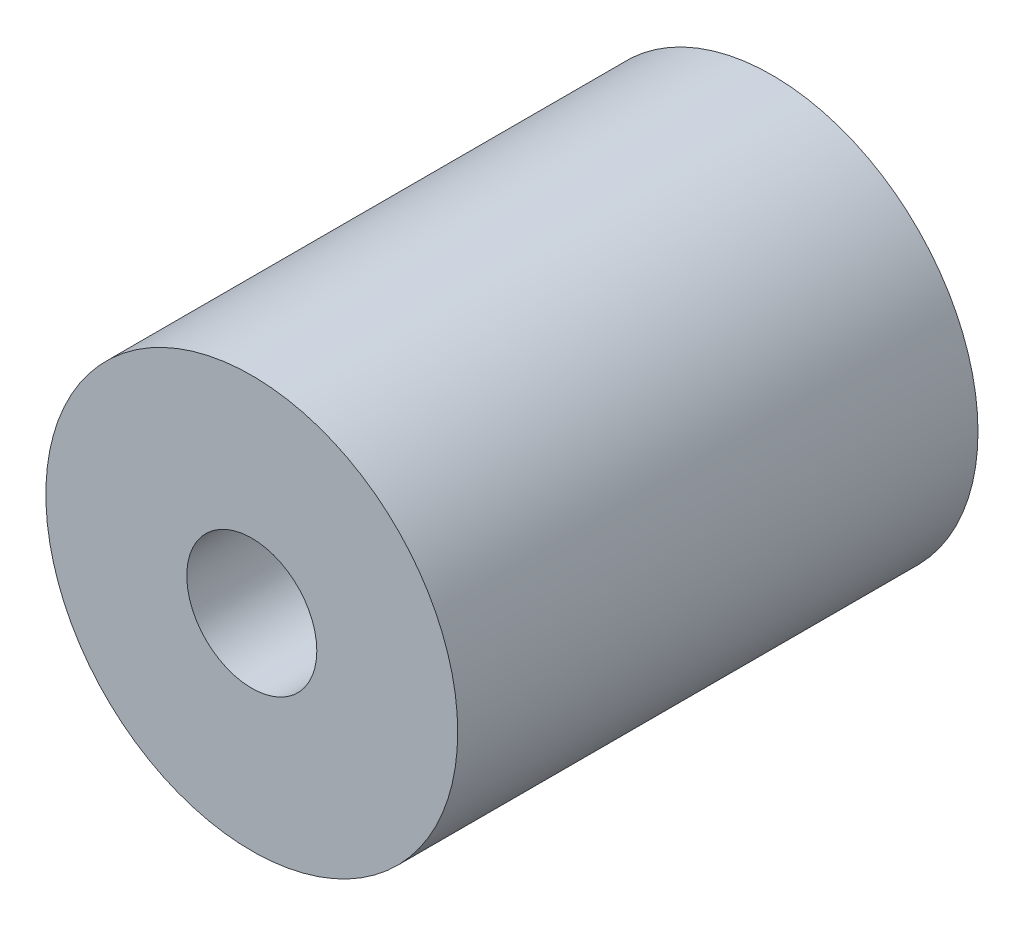
from build123d import *

# Parameters (mm, degrees)
CROQUIS1_R              = 9.5
CROQUIS1_R_2            = 3
SALIENTE_EXTRUIR1_DEPTH = 24


with BuildPart() as part:
    # Croquis1 → Saliente-Extruir1 (new body)
    with BuildSketch(Plane.XY):
        Circle(CROQUIS1_R)
        Circle(CROQUIS1_R_2, mode=Mode.SUBTRACT)
    extrude(amount=SALIENTE_EXTRUIR1_DEPTH)


solid = part.part
